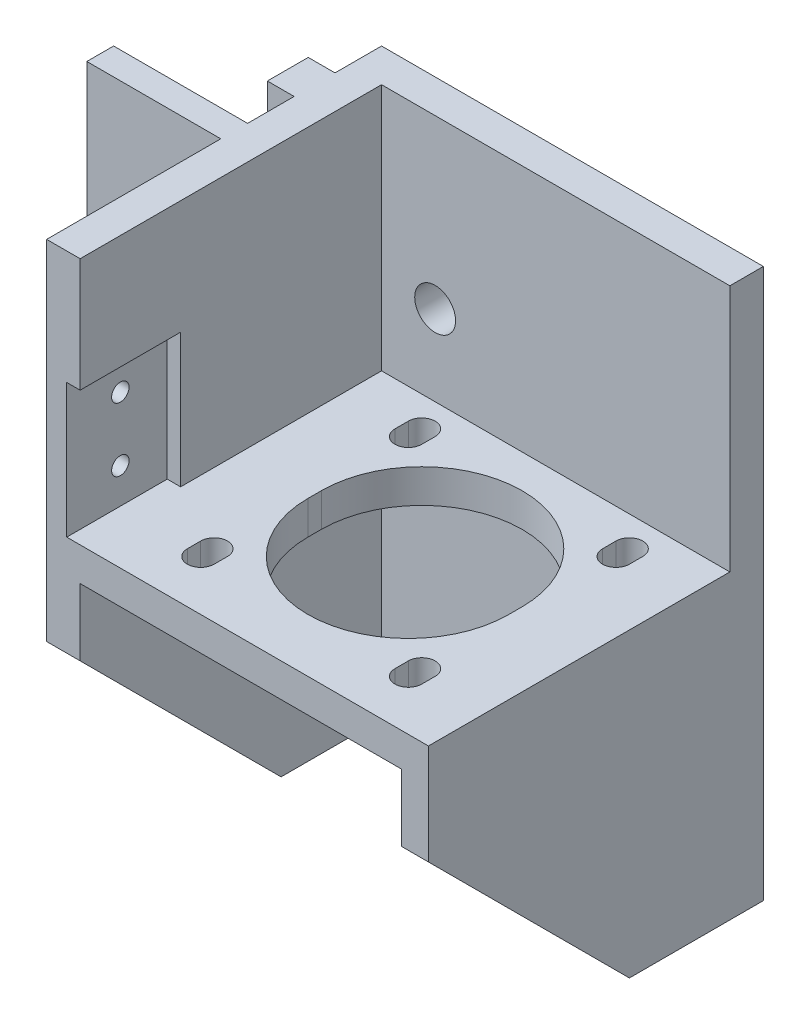
from build123d import *

# Parameters (mm, degrees)
SKETCH_1_W           = 57
SKETCH_1_H           = 50
EXTRUDE_1_DEPTH      = 5
EXTRUDE_3_DEPTH      = 30
EXTRUDE_4_DEPTH      = 40
CUT_EXTRUDE_1_DEPTH  = 80
CUT_EXTRUDE_2_DEPTH  = 80
SKETCH_7_R           = 3
CUT_EXTRUDE_6_DEPTH  = 80
SKETCH_8_W           = 6.1
SKETCH_8_H           = 75
EXTRUDE_5_DEPTH      = 4
EXTRUDE_6_DEPTH      = 20
SKETCH_10_W          = 20
SKETCH_10_H          = 5
EXTRUDE_7_DEPTH      = 26
CUT_EXTRUDE_7_DEPTH  = 26
EXTRUDE_8_DEPTH      = 7
CUT_EXTRUDE_9_DEPTH  = 7
SKETCH_16_W          = 5.535203569
SKETCH_16_H          = 7.819573295
SKETCH_16_W_2        = 5.974505439
SKETCH_16_H_2        = 8.127084604
SKETCH_16_W_3        = 7.643852547
SKETCH_16_H_3        = 8.522456287
SKETCH_16_W_4        = 7.380271425
SKETCH_16_H_4        = 8.083154417
EXTRUDE_9_DEPTH      = 5
CUT_EXTRUDE_10_DEPTH = 5
CUT_EXTRUDE_11_DEPTH = 5
SKETCH_19_R          = 3.05
CUT_EXTRUDE_12_DEPTH = 10
CUT_EXTRUDE_13_DEPTH = 10
SKETCH_22_W          = 2
SKETCH_22_H          = 20
CUT_EXTRUDE_14_DEPTH = 15
SKETCH_23_R          = 1.3
CUT_EXTRUDE_15_DEPTH = 15


with BuildPart() as part:
    # 草图1 → 凸台-拉伸1 (new body)
    with BuildSketch(Plane(origin=(0, 0, 0), x_dir=(1, 0, 0), z_dir=(0, 1, 0))):
        Rectangle(SKETCH_1_W, SKETCH_1_H)
    extrude(amount=EXTRUDE_1_DEPTH)

    # 草图2 → 凸台-拉伸3 (add)
    with BuildSketch(Plane(origin=(0, 5, 0), x_dir=(1, 0, 0), z_dir=(0, 1, 0))):
        Polygon((-28.5, -25), (-23.5, -25), (-23.5, 20), (28.5, 20), (28.5, 25), (-28.5, 25), align=None)
    extrude(amount=EXTRUDE_3_DEPTH)

    # 草图3 → 凸台-拉伸4 (add)
    with BuildSketch(Plane.XZ):
        Polygon((-28.5, -25), (28.5, -25), (28.5, 25), (24.5, 25), (24.5, -20), (-23.5, -20), (-23.5, 25), (-28.5, 25), align=None)
    extrude(amount=EXTRUDE_4_DEPTH)

    # 草图5 → 切除-拉伸1 (cut)
    with BuildSketch(Plane(origin=(28.5, 0, 0), x_dir=(0, 0, -1), z_dir=(1, 0, 0))):
        Polygon((-25, -10), (5, -40), (-25, -40), align=None)
    extrude(amount=-CUT_EXTRUDE_1_DEPTH, mode=Mode.SUBTRACT)

    # 草图6 → 切除-拉伸2 (cut)
    with BuildSketch(Plane(origin=(0, 5, 0), x_dir=(1, 0, 0), z_dir=(0, 1, 0))):
        with BuildLine():
            ThreePointArc((2.5, 14), (-12.5, -1), (2.5, -16))
            Line((2.5, -16), (2.5, 14))
        make_face()
        with BuildLine():
            Line((2.5, 14), (2.5, -16))
            ThreePointArc((2.5, -16), (13.106601718, -11.606601718), (17.5, -1))
            ThreePointArc((17.5, -1), (13.106601718, 9.606601718), (2.5, 14))
        make_face()
        with BuildLine():
            ThreePointArc((-15.5, 13), (-13.5, 15), (-11.5, 13))
            Line((-11.5, 13), (-11.5, 11))
            ThreePointArc((-11.5, 11), (-13.5, 9), (-15.5, 11))
            Line((-15.5, 11), (-15.5, 13))
        make_face()
        with BuildLine():
            Line((-15.5, -19), (-15.5, -17))
            ThreePointArc((-15.5, -17), (-13.5, -15), (-11.5, -17))
            Line((-11.5, -17), (-11.5, -19))
            ThreePointArc((-11.5, -19), (-13.5, -21), (-15.5, -19))
        make_face()
        with BuildLine():
            Line((16.5, -17), (16.5, -19))
            ThreePointArc((16.5, -19), (18.5, -21), (20.5, -19))
            Line((20.5, -19), (20.5, -17))
            ThreePointArc((20.5, -17), (18.5, -15), (16.5, -17))
        make_face()
        with BuildLine():
            ThreePointArc((16.5, 13), (18.5, 15), (20.5, 13))
            Line((20.5, 13), (20.5, 11))
            ThreePointArc((20.5, 11), (18.5, 9), (16.5, 11))
            Line((16.5, 11), (16.5, 13))
        make_face()
    extrude(amount=-CUT_EXTRUDE_2_DEPTH, mode=Mode.SUBTRACT)

    # 草图7 → 切除-拉伸6 (cut)
    with BuildSketch(Plane.XY.offset(-20)):
        with Locations((-15.5, 17)):
            Circle(SKETCH_7_R)
    extrude(amount=-CUT_EXTRUDE_6_DEPTH, mode=Mode.SUBTRACT)

    # 草图8 → 凸台-拉伸5 (add)
    with BuildSketch(Plane.ZY.offset(28.5)):
        with Locations((-15, -2.5)):
            Rectangle(SKETCH_8_W, SKETCH_8_H)
    extrude(amount=EXTRUDE_5_DEPTH)

    # 草图9 → 凸台-拉伸6 (add)
    with BuildSketch(Plane.ZY.offset(28.5)):
        Polygon((-5, -40), (-5, 35), (-1, 35), (-1, -36), align=None)
    extrude(amount=EXTRUDE_6_DEPTH)

    # 草图10 → 凸台-拉伸7 (add)
    with BuildSketch(Plane.XY.offset(-1)):
        with Locations((-38.5, 2.5)):
            Rectangle(SKETCH_10_W, SKETCH_10_H)
    extrude(amount=EXTRUDE_7_DEPTH)

    # 草图11 → 切除-拉伸7 (cut)
    with BuildSketch(Plane.XZ):
        Polygon((-48.5, 25), (-48.5, -1), (-28.5, 25), align=None)
    extrude(amount=-CUT_EXTRUDE_7_DEPTH, mode=Mode.SUBTRACT)

    # 草图14 → 凸台-拉伸8 (add)
    with BuildSketch(Plane(origin=(0, 35, 0), x_dir=(1, 0, 0), z_dir=(0, 1, 0))):
        Polygon((28.5, 25), (-28.5, 25), (-28.5, 18.05), (-32.5, 18.05), (-32.5, 11.95), (-28.5, 11.95), (-28.5, 5), (-48.5, 5), (-48.5, 1), (-28.5, 1), (-28.5, -25), (-23.5, -25), (-23.5, 20), (28.5, 20), align=None)
    extrude(amount=EXTRUDE_8_DEPTH)

    # 草图15 → 切除-拉伸9 (cut)
    with BuildSketch(Plane.XY.offset(-1)):
        with BuildLine():
            ThreePointArc((-35.95, 23.5), (-37.194157268, 25.690268193), (-39.712568438, 25.74325161))
            Line((-39.712568438, 25.74325161), (-37.287431562, 21.25674839))
            ThreePointArc((-37.287431562, 21.25674839), (-36.309731807, 22.194157268), (-35.95, 23.5))
        make_face()
        with BuildLine():
            Line((-37.287431562, 21.25674839), (-39.712568438, 25.74325161))
            ThreePointArc((-39.712568438, 25.74325161), (-40.74325161, 22.287431562), (-37.287431562, 21.25674839))
        make_face()
        with BuildLine():
            ThreePointArc((-35.95, -18), (-37.206824289, -15.802229179), (-39.738389475, -15.770898946))
            Line((-39.738389475, -15.770898946), (-37.261610525, -20.229101054))
            ThreePointArc((-37.261610525, -20.229101054), (-36.302229179, -19.293175711), (-35.95, -18))
        make_face()
        with BuildLine():
            Line((-37.261610525, -20.229101054), (-39.738389475, -15.770898946))
            ThreePointArc((-39.738389475, -15.770898946), (-40.729101054, -19.238389475), (-37.261610525, -20.229101054))
        make_face()
    extrude(amount=-CUT_EXTRUDE_9_DEPTH, mode=Mode.SUBTRACT)

    # 草图16 → 凸台-拉伸9 (add)
    with BuildSketch(Plane(origin=(0, 5, 0), x_dir=(1, 0, 0), z_dir=(0, 1, 0))):
        with Locations((-13.755717979, 12.566621799)):
            Rectangle(SKETCH_16_W, SKETCH_16_H)
        with Locations((-13.975368915, -17.503591238)):
            Rectangle(SKETCH_16_W_2, SKETCH_16_H_2)
        with Locations((18.884411, -17.70127708)):
            Rectangle(SKETCH_16_W_3, SKETCH_16_H_3)
        with Locations((18.752620439, 12.69841236)):
            Rectangle(SKETCH_16_W_4, SKETCH_16_H_4)
    extrude(amount=-EXTRUDE_9_DEPTH)

    # 草图17 → 切除-拉伸10 (cut)
    with BuildSketch(Plane(origin=(0, 5, 0), x_dir=(1, 0, 0), z_dir=(0, 1, 0))):
        with BuildLine():
            Line((16, -15.5), (16, -17.5))
            ThreePointArc((16, -17.5), (18, -19.5), (20, -17.5))
            Line((20, -17.5), (20, -15.5))
            ThreePointArc((20, -15.5), (18, -13.5), (16, -15.5))
        make_face()
        with BuildLine():
            Line((16, 15.5), (16, 13.5))
            ThreePointArc((16, 13.5), (18, 11.5), (20, 13.5))
            Line((20, 13.5), (20, 15.5))
            ThreePointArc((20, 15.5), (18, 17.5), (16, 15.5))
        make_face()
        with BuildLine():
            Line((-11, -15.5), (-11, -17.5))
            ThreePointArc((-11, -17.5), (-13, -19.5), (-15, -17.5))
            Line((-15, -17.5), (-15, -15.5))
            ThreePointArc((-15, -15.5), (-13, -13.5), (-11, -15.5))
        make_face()
    extrude(amount=-CUT_EXTRUDE_10_DEPTH, mode=Mode.SUBTRACT)

    # 草图18 → 切除-拉伸11 (cut)
    with BuildSketch(Plane(origin=(0, 5, 0), x_dir=(1, 0, 0), z_dir=(0, 1, 0))):
        with BuildLine():
            Line((-12.5, -1), (-12.5, 0))
            ThreePointArc((-12.5, 0), (2.5, 15), (17.5, 0))
            Line((17.5, 0), (17.5, -1))
            Line((17.5, -1), (17.5, -2))
            ThreePointArc((17.5, -2), (2.5, -17), (-12.5, -2))
            Line((-12.5, -2), (-12.5, -1))
        make_face()
    extrude(amount=-CUT_EXTRUDE_11_DEPTH, mode=Mode.SUBTRACT)

    # 草图19 → 切除-拉伸12 (cut)
    with BuildSketch(Plane(origin=(0, 0, -25), x_dir=(-1, 0, 0), z_dir=(0, 0, -1))):
        with Locations((15.5, 17)):
            Circle(SKETCH_19_R)
    extrude(amount=-CUT_EXTRUDE_12_DEPTH, mode=Mode.SUBTRACT)

    # 草图20 → 切除-拉伸13 (cut)
    with BuildSketch(Plane(origin=(0, 5, 0), x_dir=(1, 0, 0), z_dir=(0, 1, 0))):
        with BuildLine():
            Line((-15, 13.5), (-15, 15.5))
            ThreePointArc((-15, 15.5), (-13, 17.5), (-11, 15.5))
            Line((-11, 15.5), (-11, 13.5))
            ThreePointArc((-11, 13.5), (-13, 11.5), (-15, 13.5))
        make_face()
    extrude(amount=-CUT_EXTRUDE_13_DEPTH, mode=Mode.SUBTRACT)

    # 草图22 → 切除-拉伸14 (cut)
    with BuildSketch(Plane.XY.offset(25)):
        with Locations((-24.5, 15)):
            Rectangle(SKETCH_22_W, SKETCH_22_H)
    extrude(amount=-CUT_EXTRUDE_14_DEPTH, mode=Mode.SUBTRACT)

    # 草图23 → 切除-拉伸15 (cut)
    with BuildSketch(Plane(origin=(-25.5, 0, 0), x_dir=(0, 0, -1), z_dir=(1, 0, 0))):
        with Locations((-17, 19.75)):
            Circle(SKETCH_23_R)
        with Locations((-17, 10.25)):
            Circle(SKETCH_23_R)
    extrude(amount=-CUT_EXTRUDE_15_DEPTH, mode=Mode.SUBTRACT)


solid = part.part
